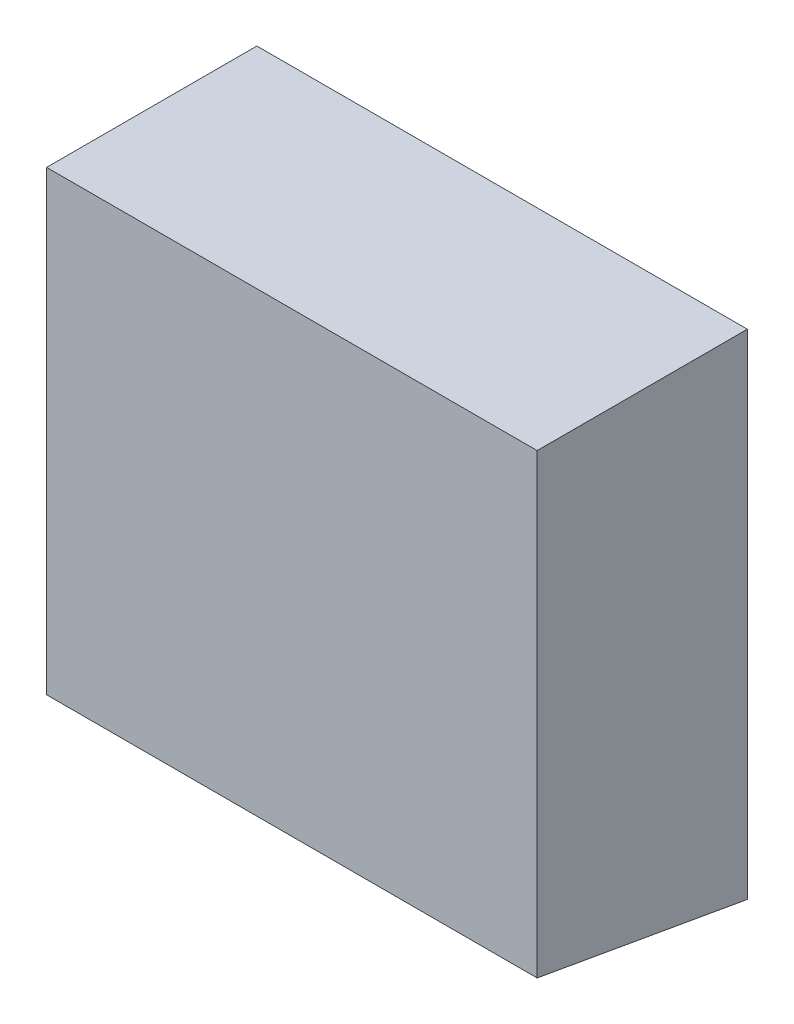
from build123d import *

# Parameters (mm, degrees)
SKETCH1_W           = 88.9
SKETCH1_H           = 38.1
BOSS_EXTRUDE1_DEPTH = 89.5
CUT_EXTRUDE1_REACH  = 129.579


with BuildPart() as part:
    # Sketch1 → Boss-Extrude1 (new body)
    with BuildSketch(Plane(origin=(0, 0, 0), x_dir=(1, 0, 0), z_dir=(0, 1, 0))):
        Rectangle(SKETCH1_W, SKETCH1_H)
    extrude(amount=BOSS_EXTRUDE1_DEPTH)

    # Sketch2 → Cut-Extrude1 (cut, up to next)
    with BuildSketch(Plane.ZY.offset(44.45), mode=Mode.PRIVATE) as cut_extrude1_sk1:
        Polygon((-19.05, 0), (19.05, 6.718057965), (19.05, 0), align=None)
    cut_extrude1_tool1 = extrude(cut_extrude1_sk1.sketch, amount=-CUT_EXTRUDE1_REACH, mode=Mode.PRIVATE) & part.part
    add(cut_extrude1_tool1.solids().sort_by_distance((-44.45, 2.239353, 6.35))[0], mode=Mode.SUBTRACT)


solid = part.part
